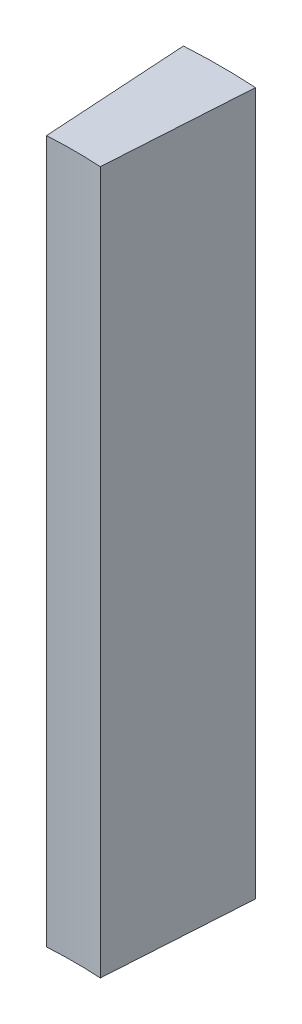
from build123d import *

# Parameters (mm, degrees)
BOSS_EXTRUDE1_DEPTH = 48


with BuildPart() as part:
    # Sketch1 → Boss-Extrude1 (new body)
    with BuildSketch(Plane(origin=(0, 0, 0), x_dir=(0.9999530758491465, 0, -0.009687419668383268), z_dir=(0, 1, 0))):
        with BuildLine():
            Line((-28.327106874, 38.467250491), (-29.047552411, 28.493236292))
            ThreePointArc((-29.047552411, 28.493236292), (-30.885025637, 28.568318579), (-32.723608623, 28.528849462))
            Line((-32.723608623, 28.528849462), (-33.250653615, 38.514951031))
            ThreePointArc((-33.250653615, 38.514951031), (-30.788136686, 38.567849194), (-28.327106874, 38.467250491))
        make_face()
    extrude(amount=BOSS_EXTRUDE1_DEPTH)


solid = part.part
